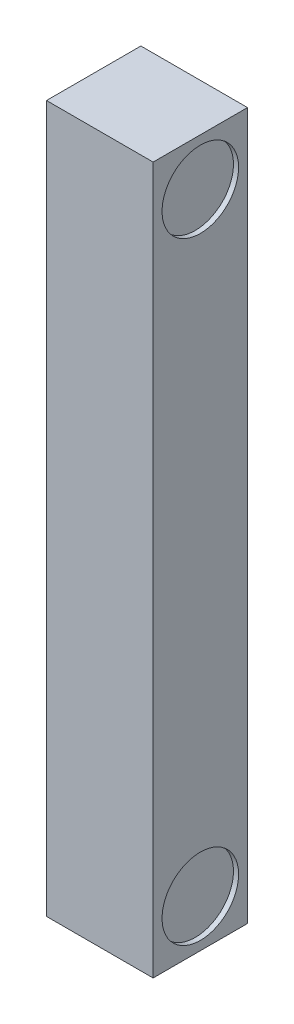
from build123d import *

# Parameters (mm, degrees)
SKETCH1_W           = 37
SKETCH1_H           = 277
BOSS_EXTRUDE1_DEPTH = 41.8
SKETCH2_R           = 15
CUT_EXTRUDE1_DEPTH  = 2


with BuildPart() as part:
    # Sketch1 → Boss-Extrude1 (new body)
    with BuildSketch(Plane(origin=(0, 0, 0), x_dir=(0, 0, -1), z_dir=(1, 0, 0))):
        Rectangle(SKETCH1_W, SKETCH1_H)
    extrude(amount=BOSS_EXTRUDE1_DEPTH)

    # Sketch2 → Cut-Extrude1 (cut)
    with BuildSketch(Plane(origin=(41.8, 0, 0), x_dir=(0, 0, -1), z_dir=(1, 0, 0))):
        with Locations((0, 120)):
            Circle(SKETCH2_R)
        with Locations((0, -120)):
            Circle(SKETCH2_R)
    extrude(amount=-CUT_EXTRUDE1_DEPTH, mode=Mode.SUBTRACT)


solid = part.part
